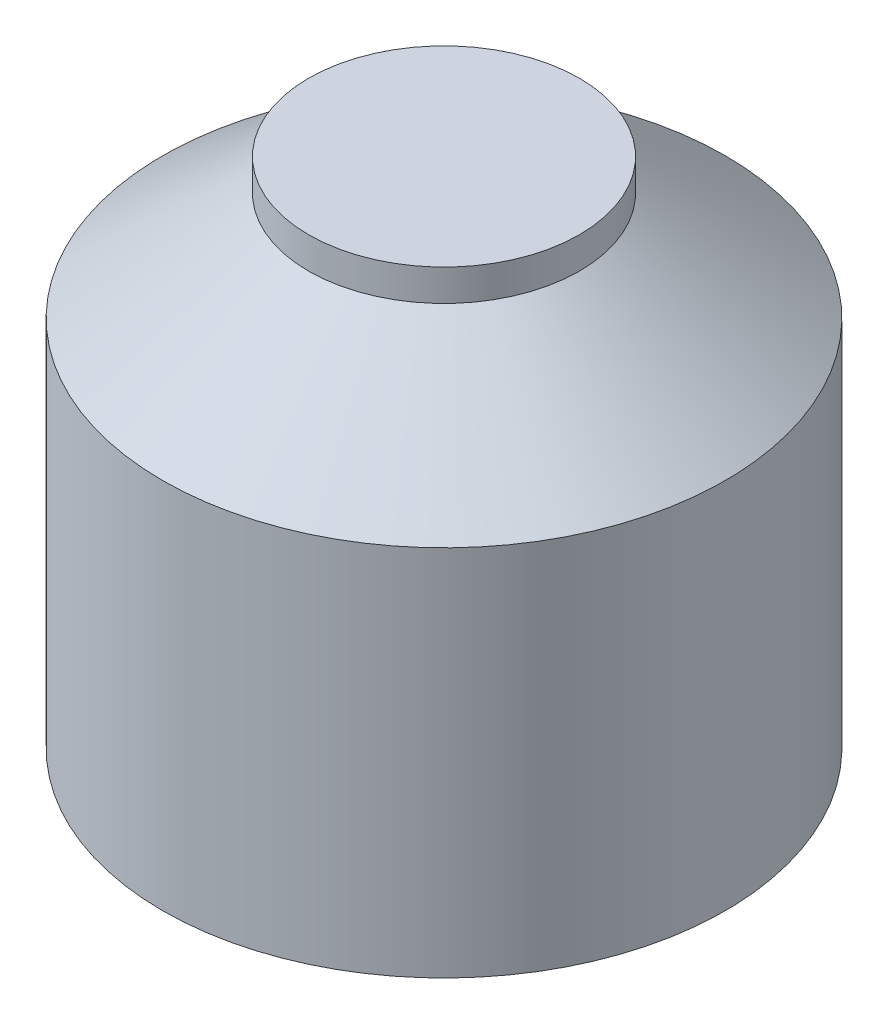
from build123d import *


with BuildPart() as part:
    # Sketch1 → Revolve1 (revolve)
    with BuildSketch(Plane.XY, mode=Mode.PRIVATE) as revolve1_sk:
        Polygon((41.529, 0), (41.529, 55), (20, 71.009603175), (20, 75.666), (0, 75.666), (0, 73.944951206), (18.820788794, 73.944951206), (18.820788794, 66.901746723), (37.529, 52.98976579), (37.529, 0), align=None)
    revolve(revolve1_sk.sketch.rotate(Axis((0, 75.666, 0), (0, -1, 0)), 90), axis=Axis((0, 75.666, 0), (0, -1, 0)))


solid = part.part
